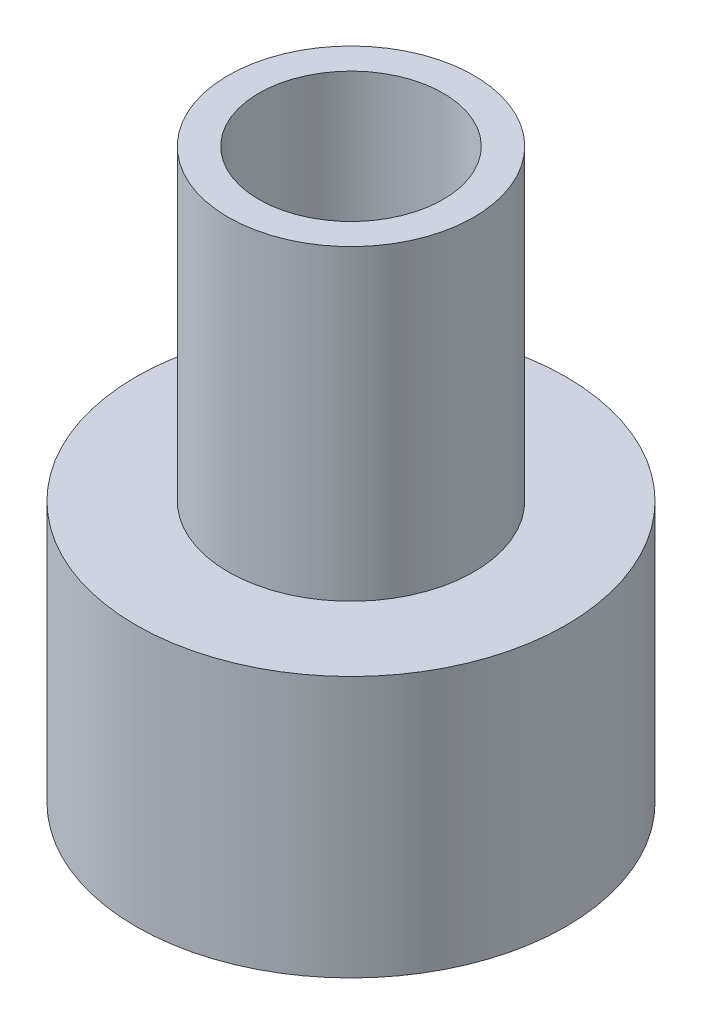
from build123d import *

# Parameters (mm, degrees)
SKETCH1_R           = 4
SKETCH1_R_2         = 3
BOSS_EXTRUDE1_DEPTH = 10
SKETCH2_R           = 7
BOSS_EXTRUDE2_DEPTH = 8.5
SKETCH3_R           = 6
CUT_EXTRUDE1_DEPTH  = 6.5


with BuildPart() as part:
    # Sketch1 → Boss-Extrude1 (new body)
    with BuildSketch(Plane(origin=(0, 0, 0), x_dir=(1, 0, 0), z_dir=(0, 1, 0))):
        with Locations(Location((0, 0, 0), (0, 0, 270))):
            Circle(SKETCH1_R)
        with Locations(Location((0, 0, 0), (0, 0, 270))):
            Circle(SKETCH1_R_2, mode=Mode.SUBTRACT)
    extrude(amount=BOSS_EXTRUDE1_DEPTH)

    # Sketch2 → Boss-Extrude2 (add)
    with BuildSketch(Plane(origin=(0, 0, 0), x_dir=(1, 0, 0), z_dir=(0, 1, 0))):
        with Locations(Location((0, 0, 0), (0, 0, 270))):
            Circle(SKETCH2_R)
    extrude(amount=-BOSS_EXTRUDE2_DEPTH)

    # Sketch3 → Cut-Extrude1 (cut)
    with BuildSketch(Plane.XZ.offset(8.5)):
        with Locations(Location((0, 0, 0), (0, 0, 270))):
            Circle(SKETCH3_R)
    extrude(amount=-CUT_EXTRUDE1_DEPTH, mode=Mode.SUBTRACT)


solid = part.part
